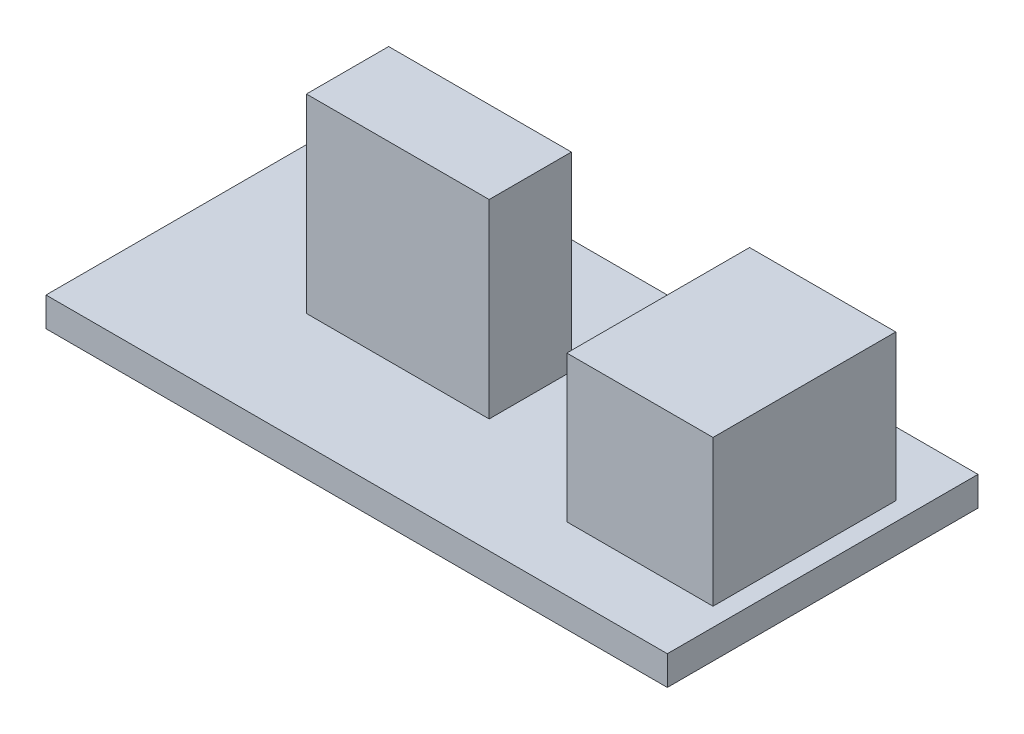
from build123d import *

# Parameters (mm, degrees)
SKETCH1_W            = 34
SKETCH1_H            = 17
BOARD_DEPTH          = 1.6
TO220_START          = 1.6
SKETCH2_W            = 10
SKETCH2_H            = 4.5
TO220_DEPTH          = 10.4
TERMINAL_BLOCK_START = 1.6
SKETCH3_W            = 8
SKETCH3_H            = 10
TERMINAL_BLOCK_DEPTH = 8


with BuildPart() as part:
    # Sketch1 → Board (new body)
    with BuildSketch(Plane(origin=(0, 0, 0), x_dir=(1, 0, 0), z_dir=(0, 1, 0))):
        Rectangle(SKETCH1_W, SKETCH1_H)
    extrude(amount=BOARD_DEPTH)

    # Sketch2 → TO220 (add)
    with BuildSketch(Plane(origin=(0, 0, 0), x_dir=(1, 0, 0), z_dir=(0, 1, 0)).offset(TO220_START)):
        with Locations((-4, 0)):
            Rectangle(SKETCH2_W, SKETCH2_H)
    extrude(amount=TO220_DEPTH)

    # Sketch3 → Terminal_Block (add)
    with BuildSketch(Plane(origin=(0, 0, 0), x_dir=(1, 0, 0), z_dir=(0, 1, 0)).offset(TERMINAL_BLOCK_START)):
        with Locations((12, 0)):
            Rectangle(SKETCH3_W, SKETCH3_H)
    extrude(amount=TERMINAL_BLOCK_DEPTH)


solid = part.part
